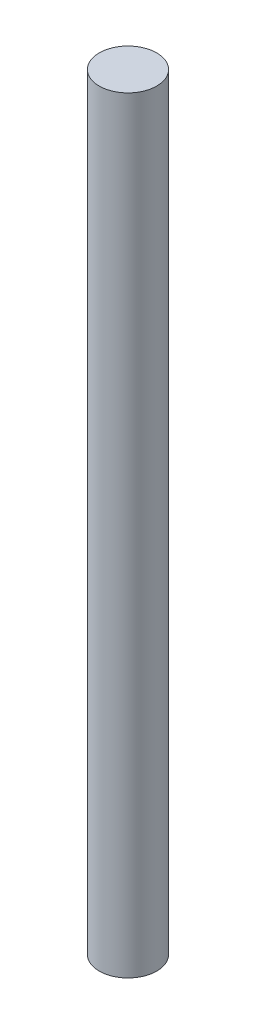
from build123d import *

# Parameters (mm, degrees)
BOSS_EXTRUDE1_DEPTH      = 10
BOSS_EXTRUDE1_DEPTH_BACK = 10
SKETCH2_R                = 0.75


with BuildPart() as part:
    # Sketch2 → Boss-Extrude1 (new, two sides: drawn at the far end of the back side and taken through both)
    with BuildSketch(Plane(origin=(0, 0, 0), x_dir=(1, 0, 0), z_dir=(0, 1, 0)).offset(-BOSS_EXTRUDE1_DEPTH_BACK)):
        Circle(SKETCH2_R)
    extrude(amount=BOSS_EXTRUDE1_DEPTH + BOSS_EXTRUDE1_DEPTH_BACK)


solid = part.part
